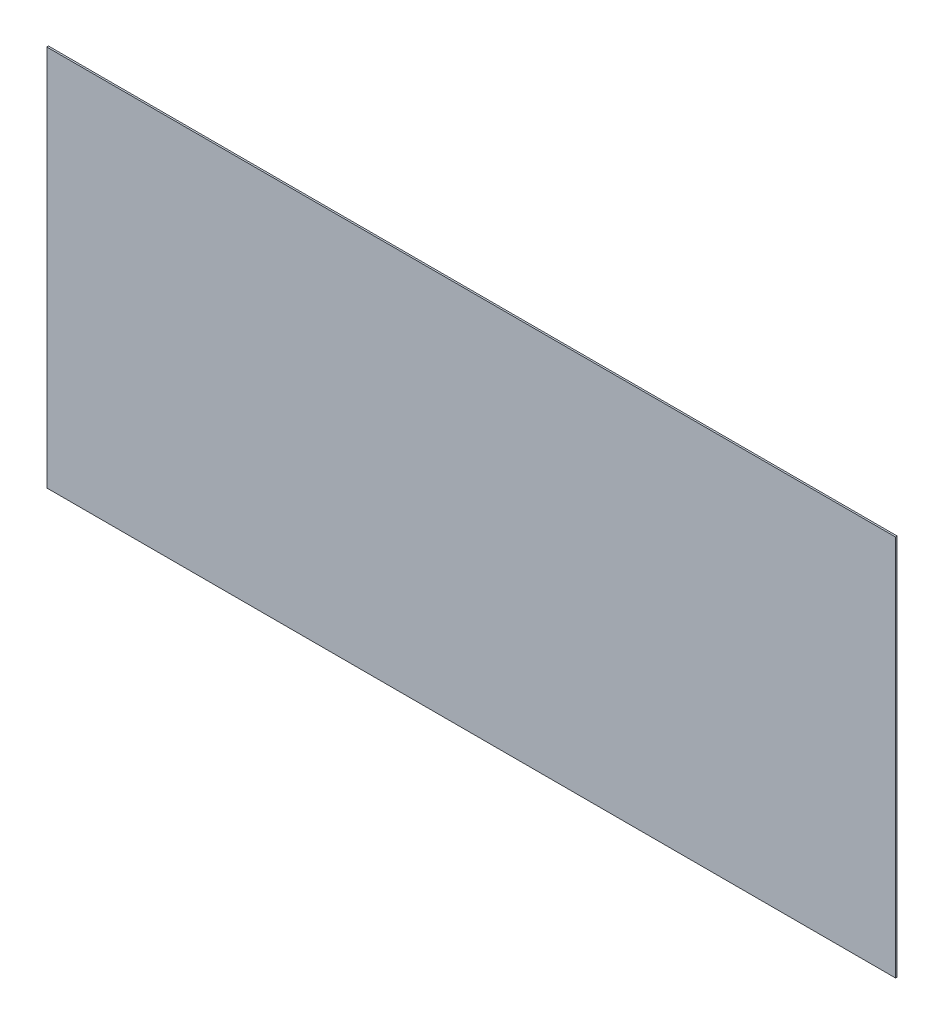
from build123d import *

# Parameters (mm, degrees)
SKETCH_1_W      = 1000
SKETCH_1_H      = 450
EXTRUDE_1_DEPTH = 2


with BuildPart() as part:
    # 草图1 → 凸台-拉伸1 (new body)
    with BuildSketch(Plane.XY):
        Rectangle(SKETCH_1_W, SKETCH_1_H)
    extrude(amount=EXTRUDE_1_DEPTH)


solid = part.part
